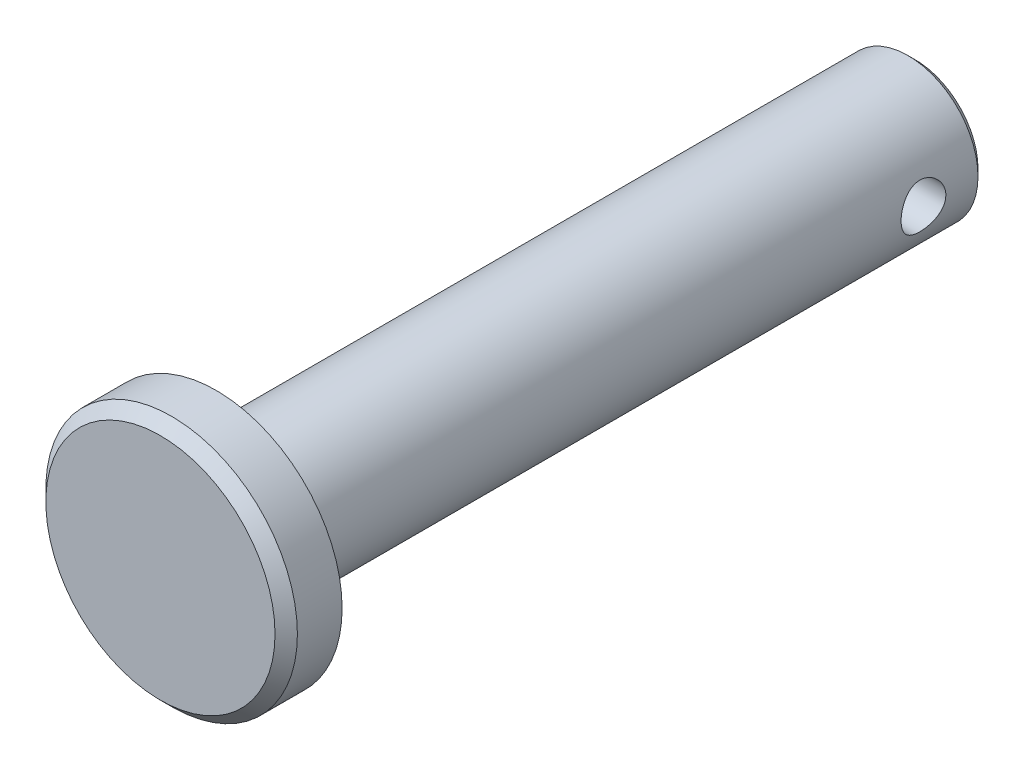
from build123d import *

# Parameters (mm, degrees)
SKETCH1_R           = 5
EXTRUDE1_DEPTH      = 25
SKETCH2_R           = 9
EXTRUDE2_DEPTH      = 4
CHAMFER1_SIZE       = 0.8
EXTRUDE3_DEPTH      = 32.670175244
EXTRUDE3_DEPTH_BACK = 32.670175244
SKETCH3_R           = 1.6
CHAMFER2_SIZE       = 0.5


with BuildPart() as part:
    # Sketch1 → Extrude1 (new, symmetric)
    with BuildSketch(Plane.XY):
        Circle(SKETCH1_R)
    extrude(amount=EXTRUDE1_DEPTH, both=True)

    # Sketch2 → Extrude2 (add)
    with BuildSketch(Plane.XY.offset(25)):
        Circle(SKETCH2_R)
    extrude(amount=EXTRUDE2_DEPTH)

    # Chamfer1
    chamfer1_edges = [part.edges().sort_by_distance(p)[0] for p in [
        (-9, 0, 29),
    ]]
    chamfer(chamfer1_edges, length=CHAMFER1_SIZE)

    # Sketch3 → Extrude3 (cut, two sides: drawn at the far end of the back side and taken through both)
    with BuildSketch(Plane(origin=(0, 0, 0), x_dir=(0, 0, -1), z_dir=(1, 0, 0)).offset(-EXTRUDE3_DEPTH_BACK)):
        with Locations(Location((20.6, 0, 0), (0, 0, 179.999999999))):
            Circle(SKETCH3_R)
    extrude(amount=EXTRUDE3_DEPTH + EXTRUDE3_DEPTH_BACK, mode=Mode.SUBTRACT)

    # Chamfer2
    chamfer2_edges = [part.edges().sort_by_distance(p)[0] for p in [
        (-5, 0, -25),
    ]]
    chamfer(chamfer2_edges, length=CHAMFER2_SIZE)


solid = part.part
